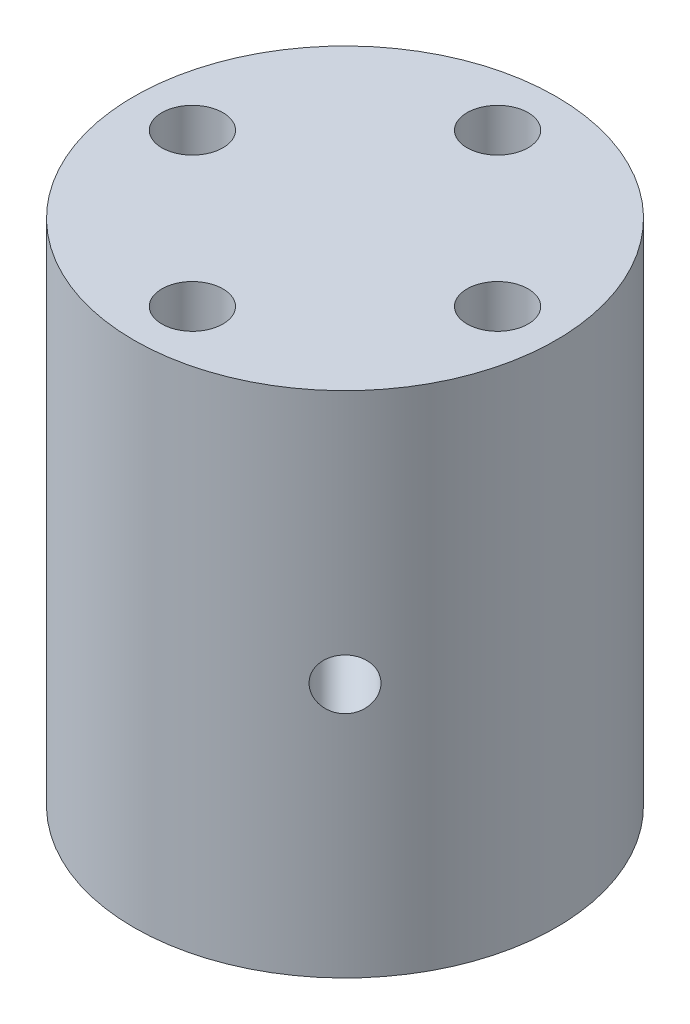
from build123d import *

# Parameters (mm, degrees)
SKETCH_1_R               = 10.375
EXTRUDE_1_DEPTH          = 25
SKETCH_2_R               = 1.5
CUT_EXTRUDE_1_DEPTH      = 29.98760511
CUT_EXTRUDE_2_DEPTH      = 29.98760511
CUT_EXTRUDE_2_DEPTH_BACK = 29.98760511
SKETCH_3_R               = 1.25


with BuildPart() as part:
    # 草图1 → 凸台-拉伸1 (new body)
    with BuildSketch(Plane(origin=(0, 0, 0), x_dir=(1, 0, 0), z_dir=(0, 1, 0))):
        Circle(SKETCH_1_R)
    extrude(amount=EXTRUDE_1_DEPTH)

    # 草图2 → 切除-拉伸1 (cut, through all)
    with BuildSketch(Plane(origin=(0, 25, 0), x_dir=(1, 0, 0), z_dir=(0, 1, 0))):
        with Locations((0, 7.5)):
            Circle(SKETCH_2_R)
        with Locations((-7.5, 0)):
            Circle(SKETCH_2_R)
        with Locations((7.5, 0)):
            Circle(SKETCH_2_R)
        with Locations((0, -7.5)):
            Circle(SKETCH_2_R)
    extrude(amount=-CUT_EXTRUDE_1_DEPTH, mode=Mode.SUBTRACT)

    # 草图3 → 切除-拉伸2 (cut, two sides: drawn at the far end of the back side and taken through both)
    with BuildSketch(Plane(origin=(0, 0, 0), x_dir=(0, 1, 0), z_dir=(0.7071067811865488, 0, 0.7071067811865464)).offset(-CUT_EXTRUDE_2_DEPTH_BACK)):
        with Locations((12.5, 0)):
            Circle(SKETCH_3_R)
    extrude(amount=CUT_EXTRUDE_2_DEPTH + CUT_EXTRUDE_2_DEPTH_BACK, mode=Mode.SUBTRACT)


solid = part.part
